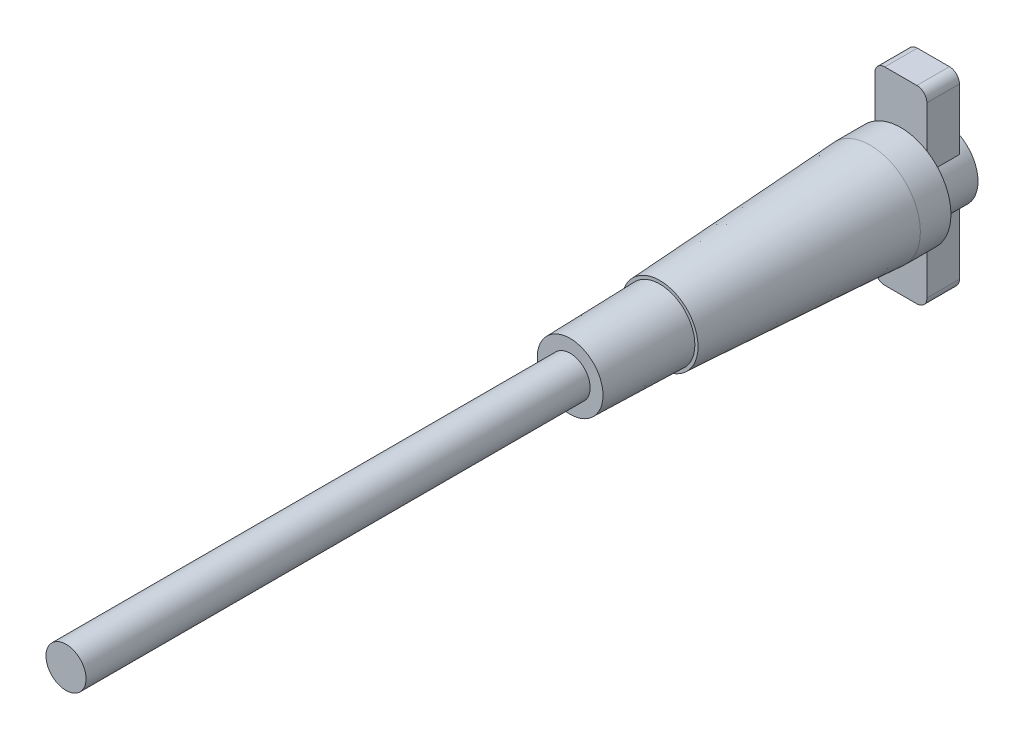
from build123d import *

# Parameters (mm, degrees)
BOSS_EXTRUDE1_DEPTH = 3.302


with BuildPart() as part:
    # Sketch2 → Revolve1 (revolve)
    with BuildSketch(Plane(origin=(0, 0, 0), x_dir=(0, 0, -1), z_dir=(1, 0, 0)), mode=Mode.PRIVATE) as revolve1_sk:
        Polygon((0, 3.556), (-4.2672, 3.556), (-4.2672, 5.08), (-7.366, 5.08), (-28.702, 3.8735), (-28.702, 3.556), (-37.7952, 3.33375), (-37.7952, 2.032), (-88.9, 2.032), (-88.9, 0), (0, 0), align=None)
    revolve(revolve1_sk.sketch.rotate(Axis((0, 0, 88.9), (0, 0, -1)), 90), axis=Axis((0, 0, 88.9), (0, 0, -1)))

    # Sketch3 → Boss-Extrude1 (add)
    with BuildSketch(Plane(origin=(0, 0, 4.2672), x_dir=(-1, 0, 0), z_dir=(0, 0, -1))):
        with BuildLine():
            Line((-1.6256, -9.5885), (1.6256, -9.5885))
            ThreePointArc((1.6256, -9.5885), (2.34402049, -9.29092049), (2.6416, -8.5725))
            Line((2.6416, -8.5725), (2.6416, 8.5725))
            ThreePointArc((2.6416, 8.5725), (2.34402049, 9.29092049), (1.6256, 9.5885))
            Line((1.6256, 9.5885), (-1.6256, 9.5885))
            ThreePointArc((-1.6256, 9.5885), (-2.34402049, 9.29092049), (-2.6416, 8.5725))
            Line((-2.6416, 8.5725), (-2.6416, -8.5725))
            ThreePointArc((-2.6416, -8.5725), (-2.34402049, -9.29092049), (-1.6256, -9.5885))
        make_face()
    extrude(amount=BOSS_EXTRUDE1_DEPTH)


solid = part.part
